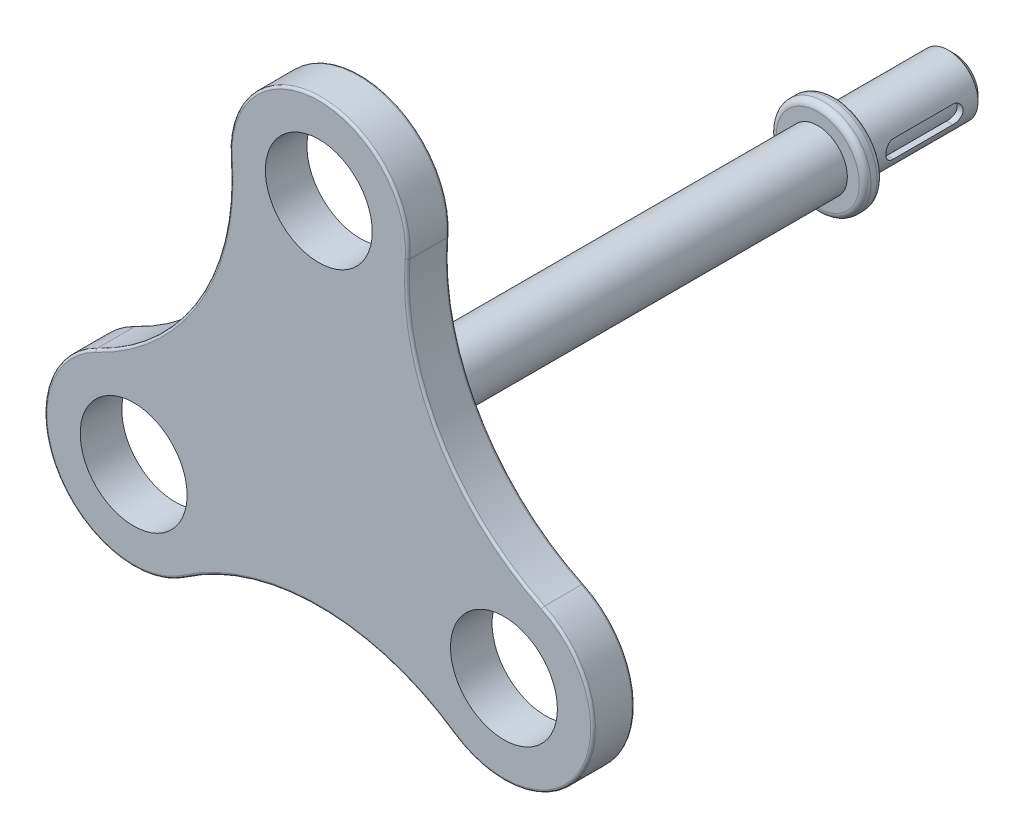
from build123d import *

# Parameters (mm, degrees)
SKETCH1_R               = 7.5
SKETCH1_R_2             = 4.5
BOSS_EXTRUDE1_DEPTH     = 3.5
SKETCH2_R               = 2.5
BOSS_EXTRUDE2_DEPTH     = 50
BOSS_EXTRUDE3_START     = -10
SKETCH3_R               = 4
BOSS_EXTRUDE3_DEPTH     = 1.5
CUT_EXTRUDE1_REACH      = 67.69
CUT_EXTRUDE1_END_RADIUS = 2
CUT_EXTRUDE1_START      = 5
CHAMFER1_SIZE           = 0.5
FILLET1_R               = 0.5
FILLET2_R               = 0.2


with BuildPart() as part:
    # Sketch1 → Boss-Extrude1 (new body)
    # profile 1 of 4: a face of its own
    with BuildSketch(Plane.XY):
        with Locations((0, 18)):
            Circle(SKETCH1_R)
        with Locations((0, 18)):
            Circle(SKETCH1_R_2, mode=Mode.SUBTRACT)
    # profile 2 of 4: a face of its own
    with BuildSketch(Plane.XY):
        with Locations((15.588457268, -9)):
            Circle(SKETCH1_R)
        with Locations((15.588457268, -9)):
            Circle(SKETCH1_R_2, mode=Mode.SUBTRACT)
    # profile 3 of 4: a face of its own
    with BuildSketch(Plane.XY):
        with BuildLine():
            ThreePointArc((7.476559852, 17.407502934), (0, 10.5), (-7.476559852, 17.407502934))
            ThreePointArc((-7.476559852, 17.407502934), (-10.093544717, 5.827510759), (-18.813619684, -2.228860702))
            ThreePointArc((-18.813619684, -2.228860702), (-11.584628982, -2.658126534), (-8.088457268, -9))
            ThreePointArc((-8.088457268, -9), (-8.950103527, -12.490309386), (-11.337059831, -15.178642232))
            ThreePointArc((-11.337059831, -15.178642232), (0, -11.655021518), (11.337059831, -15.178642232))
            ThreePointArc((11.337059831, -15.178642232), (9.09326674, -5.25), (18.813619684, -2.228860702))
            ThreePointArc((18.813619684, -2.228860702), (10.093544717, 5.827510759), (7.476559852, 17.407502934))
        make_face()
    # profile 4 of 4: a face of its own
    with BuildSketch(Plane.XY):
        with Locations((-15.588457268, -9)):
            Circle(SKETCH1_R)
        with Locations((-15.588457268, -9)):
            Circle(SKETCH1_R_2, mode=Mode.SUBTRACT)
    extrude(amount=BOSS_EXTRUDE1_DEPTH)

    # Sketch2 → Boss-Extrude2 (add)
    with BuildSketch(Plane(origin=(0, 0, 0), x_dir=(-1, 0, 0), z_dir=(0, 0, -1))):
        with Locations(Location((0, 0, 0), (0, 0, 180))):
            Circle(SKETCH2_R)
    extrude(amount=BOSS_EXTRUDE2_DEPTH)

    # Sketch3 → Boss-Extrude3 (add)
    with BuildSketch(Plane(origin=(0, 0, -50), x_dir=(-1, 0, 0), z_dir=(0, 0, -1)).offset(BOSS_EXTRUDE3_START)):
        Circle(SKETCH3_R)
    extrude(amount=-BOSS_EXTRUDE3_DEPTH)

    # Cut-Extrude1: up to this cylinder (the profile starts outside it)
    cut_extrude1_end = Plane(origin=(0, 0, -45), z_dir=(0, 0, 1)) * Cylinder(CUT_EXTRUDE1_END_RADIUS, 140.38, mode=Mode.PRIVATE)
    # Sketch5 → Cut-Extrude1 (cut, up to the surface)
    with BuildSketch(Plane(origin=(0, 0, 0), x_dir=(0, 0, -1), z_dir=(1, 0, 0)).offset(CUT_EXTRUDE1_START), mode=Mode.PRIVATE) as cut_extrude1_sk1:
        with BuildLine():
            Line((42.5, 0.75), (47.5, 0.75))
            ThreePointArc((47.5, 0.75), (48.25, 0), (47.5, -0.75))
            Line((47.5, -0.75), (42.5, -0.75))
            ThreePointArc((42.5, -0.75), (41.75, 0), (42.5, 0.75))
        make_face()
    cut_extrude1_tool1 = extrude(cut_extrude1_sk1.sketch, amount=-CUT_EXTRUDE1_REACH, mode=Mode.PRIVATE) - cut_extrude1_end
    add(cut_extrude1_tool1.solids().sort_by_distance((5, 0, -45))[0], mode=Mode.SUBTRACT)

    # Chamfer1
    chamfer1_edges = [part.edges().sort_by_distance(p)[0] for p in [
        (-2.5, 0, -50),
    ]]
    chamfer(chamfer1_edges, length=CHAMFER1_SIZE)

    # Fillet1
    fillet1_edges = [part.edges().sort_by_distance(p)[0] for p in [
        (4, 0, -38.5),
        (4, 0, -40),
    ]]
    fillet(fillet1_edges, radius=FILLET1_R)

    # Fillet2
    fillet2_edges = [part.edges().sort_by_distance(p)[0] for p in [
        (10.093544717, 5.827510759, 0),
        (22.083647797, -12.75, 0),
        (0, 25.5, 3.5),
        (0, -11.655021518, 0),
        (-22.083647797, -12.75, 0),
        (-10.093544717, 5.827510759, 0),
        (0, 25.5, 0),
        (-10.093544717, 5.827510759, 3.5),
        (-22.083647797, -12.75, 3.5),
        (0, -11.655021518, 3.5),
        (22.083647797, -12.75, 3.5),
        (10.093544717, 5.827510759, 3.5),
    ]]
    fillet(fillet2_edges, radius=FILLET2_R)


solid = part.part
